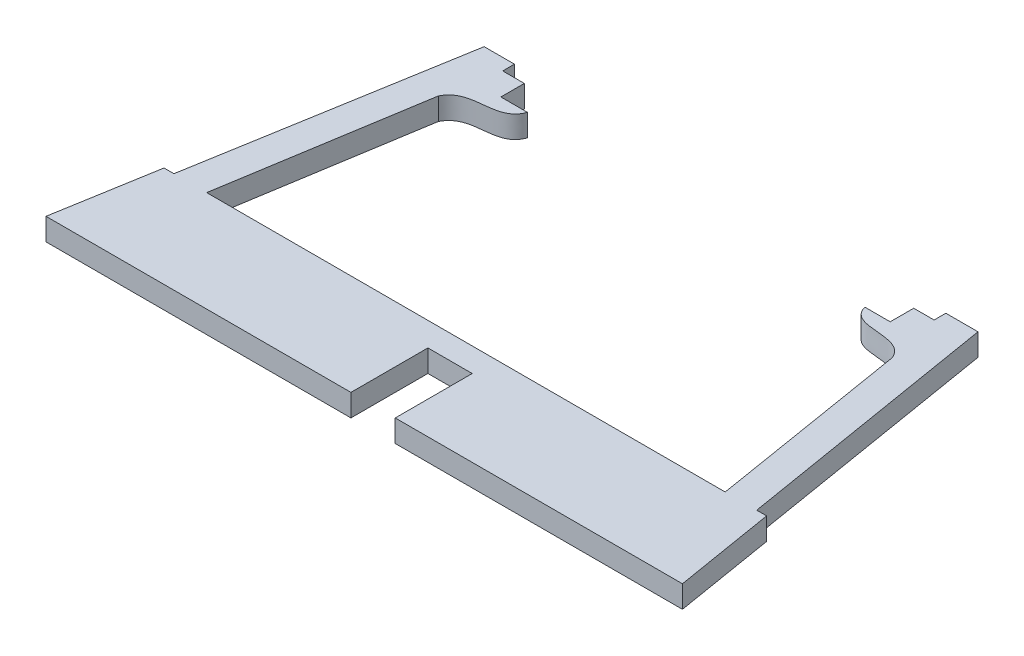
from build123d import *

# Parameters (mm, degrees)
EXTRUDE_1_DEPTH = 4


with BuildPart() as part:
    # 草图1 → 凸台-拉伸1 (new body)
    with BuildSketch(Plane(origin=(0, 0, 0), x_dir=(1, 0, 0), z_dir=(0, 1, 0))):
        with BuildLine():
            Line((-19.428200902, -5.776577465), (-24.227594621, -5.776577465))
            Line((-24.227594621, -5.776577465), (-24.227594621, -1.535252783))
            Line((-24.227594621, -1.535252783), (-28.134077881, -1.535252783))
            Line((-28.134077881, -1.535252783), (-28.134077881, 0.585409558))
            Line((-28.134077881, 0.585409558), (-33.603154445, 0.585409558))
            Line((-33.603154445, 0.585409558), (-41.750962387, -47.296913826))
            Line((-41.750962387, -47.296913826), (-43.536783306, -47.296913826))
            Line((-43.536783306, -47.296913826), (-46.636151448, -65.511008799))
            Line((-46.636151448, -65.511008799), (8.433030865, -65.511008799))
            Line((8.433030865, -65.511008799), (8.433030865, -51.611008799))
            Line((8.433030865, -51.611008799), (16.433030865, -51.611008799))
            Line((16.433030865, -51.611008799), (16.433030865, -65.511008799))
            Line((16.433030865, -65.511008799), (68.300251733, -65.511008799))
            Line((68.300251733, -65.511008799), (65.286678932, -47.296913826))
            Line((65.286678932, -47.296913826), (63.500858013, -47.296913826))
            Line((63.500858013, -47.296913826), (55.578594097, 0.585409558))
            Line((55.578594097, 0.585409558), (49.7723597, 0.585409558))
            Line((49.7723597, 0.585409558), (49.7723597, -1.535252783))
            Line((49.7723597, -1.535252783), (46.089104055, -1.535252783))
            Line((46.089104055, -1.535252783), (46.089104055, -5.776577465))
            Line((46.089104055, -5.776577465), (41.512937951, -5.776577465))
            add(Edge.make_bspline(
                [(41.512937951, -5.776577465), (42.69533512, -10.410562899), (50.01726791, -6.582058067), (51.893022041, -11.245654029)],
                knots=[0, 0, 0, 0, 1, 1, 1, 1], degree=3))
            Line((51.893022041, -11.245654029), (57.808553835, -47.296913826))
            Line((57.808553835, -47.296913826), (-35.835430593, -47.296913826))
            Line((-35.835430593, -47.296913826), (-30.031512607, -11.245654029))
            add(Edge.make_bspline(
                [(-19.428200902, -5.776577465), (-21.07412713, -10.350937498), (-27.778264505, -6.819763811), (-30.031512607, -11.245654029)],
                knots=[0, 0, 0, 0, 1, 1, 1, 1], degree=3))
        make_face()
    extrude(amount=EXTRUDE_1_DEPTH)


solid = part.part
